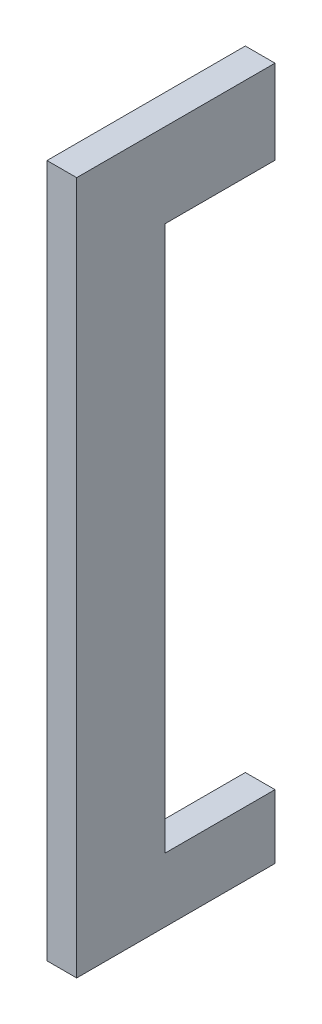
from build123d import *

# Parameters (mm, degrees)
BOSS_EXTRUDE1_DEPTH = 3


with BuildPart() as part:
    # Sketch1 → Boss-Extrude1 (new body)
    with BuildSketch(Plane(origin=(0, 0, 0), x_dir=(0, 0, -1), z_dir=(1, 0, 0))):
        Polygon((20.042546164, 0), (20.042546164, 6.463925393), (8.943768646, 6.463925393), (8.943768646, 61.542546164), (20.042546164, 61.542546164), (20.042546164, 70.042546164), (0, 70.042546164), (0, 0), align=None)
    extrude(amount=BOSS_EXTRUDE1_DEPTH)


solid = part.part
